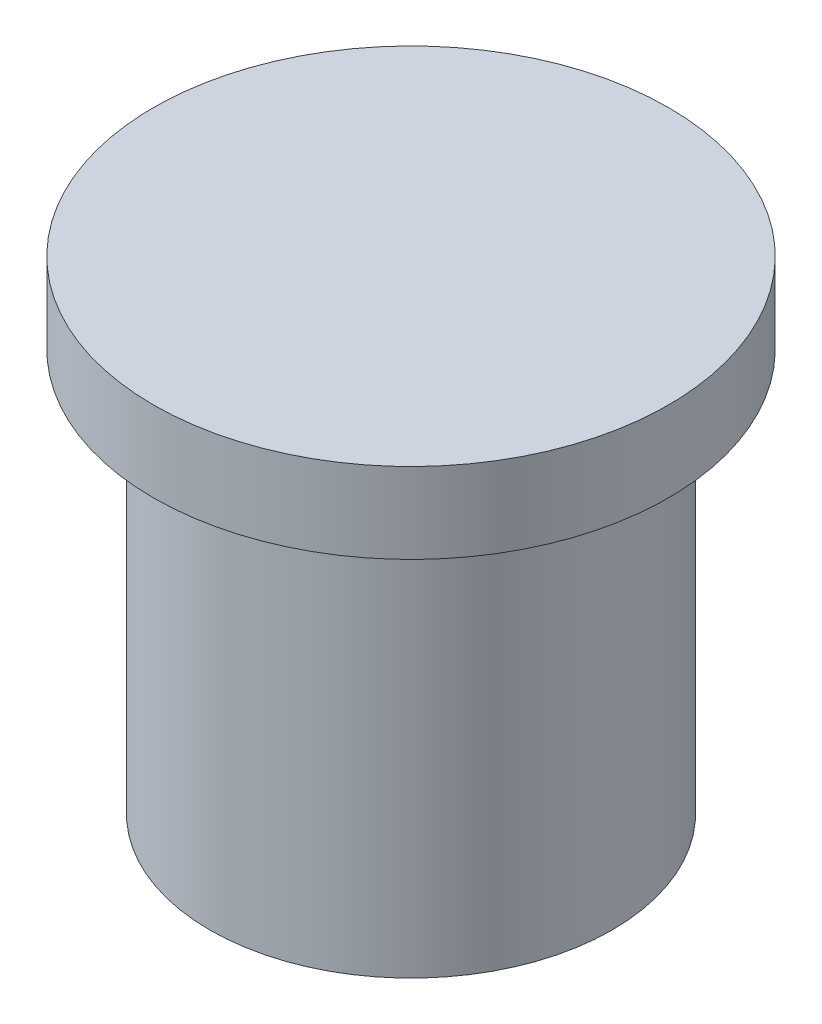
from build123d import *

# Parameters (mm, degrees)
SKETCH_1_R      = 2.5
EXTRUDE_1_DEPTH = 5
SKETCH_2_R      = 3.2
EXTRUDE_2_DEPTH = 1


with BuildPart() as part:
    # Эскиз1 → Бобышка-Вытянуть1 (new body)
    with BuildSketch(Plane(origin=(0, 0, 0), x_dir=(1, 0, 0), z_dir=(0, 1, 0))):
        with Locations(Location((0, 0, 0), (0, 0, 270))):
            Circle(SKETCH_1_R)
    extrude(amount=EXTRUDE_1_DEPTH)

    # Эскиз2 → Бобышка-Вытянуть2 (add)
    with BuildSketch(Plane(origin=(0, 5, 0), x_dir=(1, 0, 0), z_dir=(0, 1, 0))):
        with Locations(Location((0, 0, 0), (0, 0, 270))):
            Circle(SKETCH_2_R)
    extrude(amount=EXTRUDE_2_DEPTH)


solid = part.part
